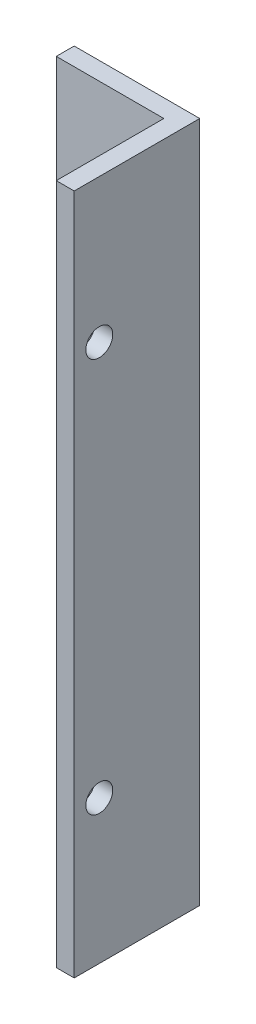
from build123d import *

# Parameters (mm, degrees)
EXTRUDE_1_DEPTH     = 76
SKETCH_3_R          = 1.5
CUT_EXTRUDE_1_DEPTH = 76
SKETCH_4_R          = 2.5
CUT_EXTRUDE_2_DEPTH = 76


with BuildPart() as part:
    # 草图2 → 凸台-拉伸1 (new body)
    with BuildSketch(Plane(origin=(0, 0, 0), x_dir=(1, 0, 0), z_dir=(0, 1, 0))):
        Polygon((0, 0), (0, 14), (-14, 14), (-14, 12), (-2, 12), (-2, 0), align=None)
    extrude(amount=EXTRUDE_1_DEPTH)

    # 草图3 → 切除-拉伸1 (cut)
    with BuildSketch(Plane(origin=(0, 0, 0), x_dir=(0, 0, -1), z_dir=(1, 0, 0))):
        with Locations((2.8, 60)):
            Circle(SKETCH_3_R)
        with Locations((2.8, 16)):
            Circle(SKETCH_3_R)
    extrude(amount=-CUT_EXTRUDE_1_DEPTH, mode=Mode.SUBTRACT)

    # 草图4 → 切除-拉伸2 (cut)
    with BuildSketch(Plane(origin=(0, 0, -14), x_dir=(-1, 0, 0), z_dir=(0, 0, -1))):
        with Locations((7, 23)):
            Circle(SKETCH_4_R)
        with Locations((7, 53)):
            Circle(SKETCH_4_R)
    extrude(amount=-CUT_EXTRUDE_2_DEPTH, mode=Mode.SUBTRACT)


solid = part.part
